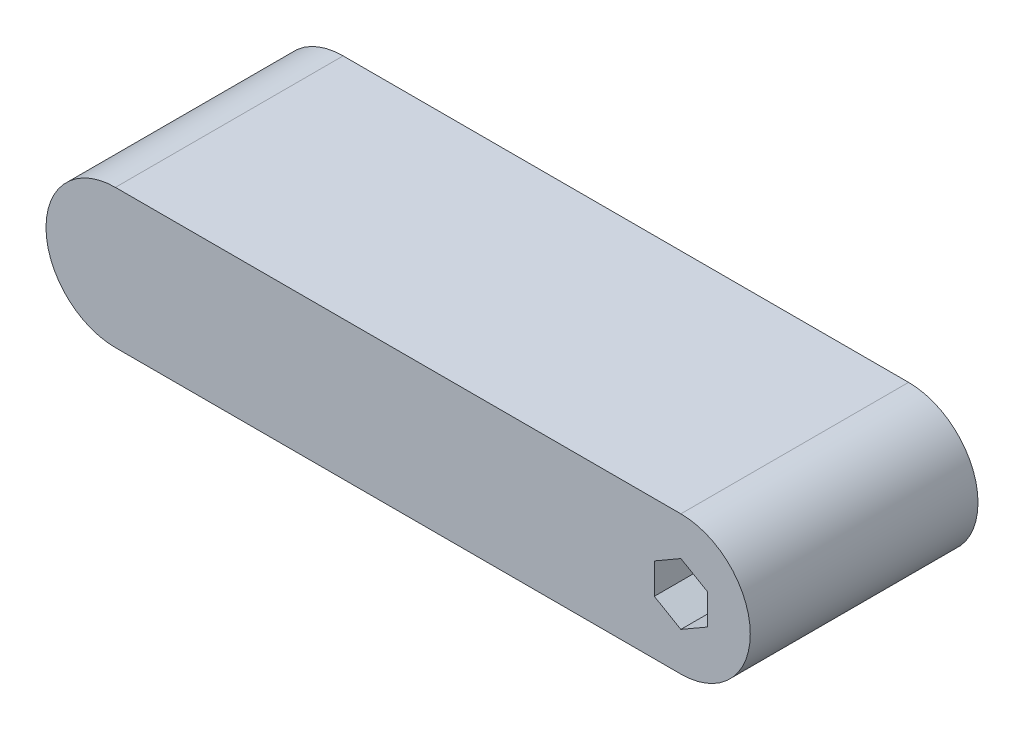
from build123d import *

# Parameters (mm, degrees)
BOSS_EXTRUDE1_DEPTH = 30
CUT_EXTRUDE1_DEPTH  = 90.32223687


with BuildPart() as part:
    # Sketch1 → Boss-Extrude1 (new body)
    with BuildSketch(Plane.XY):
        with BuildLine():
            Line((0, -9.14322974), (-74.492069921, -9.14322974))
            ThreePointArc((-74.492069921, -9.14322974), (-83.635299661, 0), (-74.492069921, 9.14322974))
            Line((-74.492069921, 9.14322974), (0, 9.14322974))
            ThreePointArc((0, 9.14322974), (9.14322974, 0), (0, -9.14322974))
        make_face()
    extrude(amount=BOSS_EXTRUDE1_DEPTH)

    # Sketch2 → Cut-Extrude1 (cut, through all)
    with BuildSketch(Plane.XY.offset(30)):
        Polygon((-3.5, 2.020725942), (-3.5, -2.020725942), (0, -4.041451884), (3.5, -2.020725942), (3.5, 2.020725942), (0, 4.041451884), align=None)
    extrude(amount=-CUT_EXTRUDE1_DEPTH, mode=Mode.SUBTRACT)


solid = part.part
